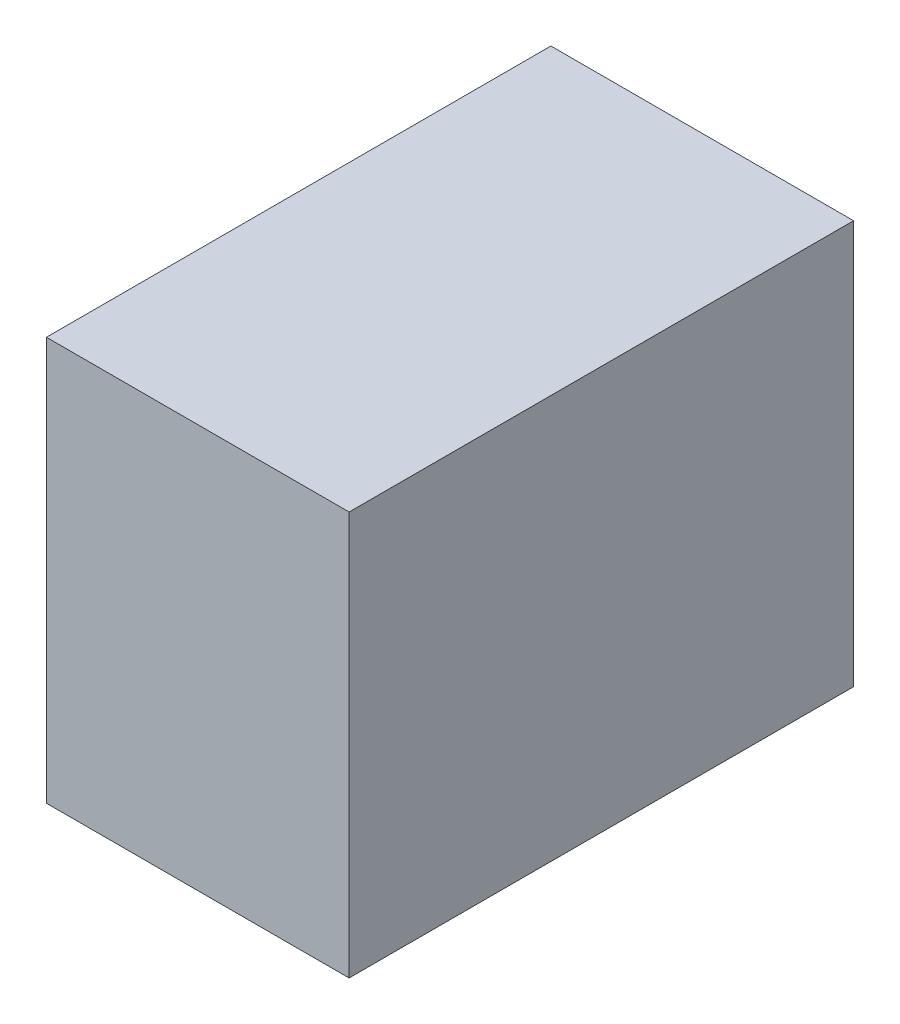
from build123d import *

# Parameters (mm, degrees)
SKETCH1_W           = 76.2
SKETCH1_H           = 101.6
BOSS_EXTRUDE1_DEPTH = 127


with BuildPart() as part:
    # Sketch1 → Boss-Extrude1 (new body)
    with BuildSketch(Plane.XY):
        Rectangle(SKETCH1_W, SKETCH1_H)
    extrude(amount=BOSS_EXTRUDE1_DEPTH)


solid = part.part
